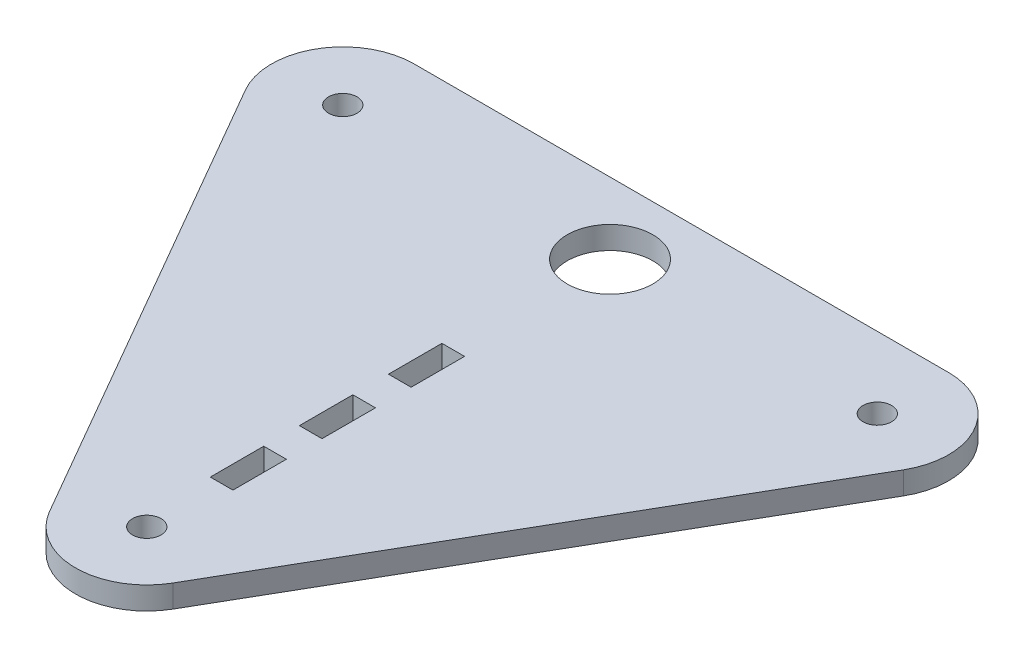
from build123d import *

# Parameters (mm, degrees)
ESQUISSE1_R             = 4
BOSS_EXTRU_1_DEPTH      = 6.35
ESQUISSE2_W             = 6.35
ESQUISSE2_H             = 15
ENL_V_MAT_EXTRU_1_DEPTH = 128.633547706
ESQUISSE3_R             = 12
ENL_V_MAT_EXTRU_2_DEPTH = 128.633547706


with BuildPart() as part:
    # Esquisse1 → Boss.-Extru.1 (new body)
    with BuildSketch(Plane(origin=(0, 0, 0), x_dir=(1, 0, 0), z_dir=(0, 1, 0))):
        with BuildLine():
            Line((-92.323711721, 55.00555093), (-17.323711721, -74.99444907))
            ThreePointArc((-17.323711721, -74.99444907), (0, -85), (17.323711721, -74.99444907))
            Line((17.323711721, -74.99444907), (92.323711721, 55.00555093))
            ThreePointArc((92.323711721, 55.00555093), (92.318905586, 75.00277508), (75, 85))
            Line((75, 85), (-75, 85))
            ThreePointArc((-75, 85), (-92.318905586, 75.00277508), (-92.323711721, 55.00555093))
        make_face()
        with Locations(Location((-75, 65, 0), (0, 0, 270))):
            Circle(ESQUISSE1_R, mode=Mode.SUBTRACT)
        with Locations(Location((75, 65, 0), (0, 0, 270))):
            Circle(ESQUISSE1_R, mode=Mode.SUBTRACT)
        with Locations(Location((0, -65, 0), (0, 0, 270))):
            Circle(ESQUISSE1_R, mode=Mode.SUBTRACT)
    extrude(amount=BOSS_EXTRU_1_DEPTH)

    # Esquisse2 → Enlèv. mat.-Extru.1 (cut, through all)
    with BuildSketch(Plane(origin=(0, 6.35, 0), x_dir=(1, 0, 0), z_dir=(0, 1, 0))):
        with Locations((0, -11.5)):
            Rectangle(ESQUISSE2_W, ESQUISSE2_H)
        with Locations((0, 13.5)):
            Rectangle(ESQUISSE2_W, ESQUISSE2_H)
        with Locations((0, -36.5)):
            Rectangle(ESQUISSE2_W, ESQUISSE2_H)
    extrude(amount=-ENL_V_MAT_EXTRU_1_DEPTH, mode=Mode.SUBTRACT)

    # Esquisse3 → Enlèv. mat.-Extru.2 (cut, through all)
    with BuildSketch(Plane(origin=(0, 6.35, 0), x_dir=(1, 0, 0), z_dir=(0, 1, 0))):
        with Locations(Location((0, 65, 0), (0, 0, 270))):
            Circle(ESQUISSE3_R)
    extrude(amount=-ENL_V_MAT_EXTRU_2_DEPTH, mode=Mode.SUBTRACT)


solid = part.part
